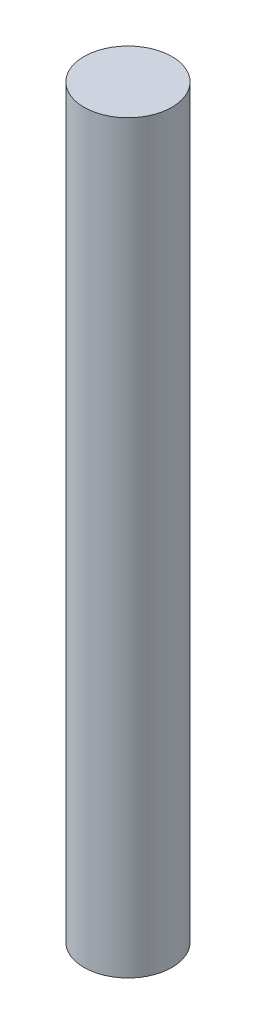
from build123d import *

# Parameters (mm, degrees)
SKETCH1_R           = 7.375
BOSS_EXTRUDE1_DEPTH = 125


with BuildPart() as part:
    # Sketch1 → Boss-Extrude1 (new body)
    with BuildSketch(Plane(origin=(0, 0, 0), x_dir=(1, 0, 0), z_dir=(0, 1, 0))):
        with Locations(Location((0, 0, 0), (0, 0, 270))):
            Circle(SKETCH1_R)
    extrude(amount=BOSS_EXTRUDE1_DEPTH)


solid = part.part
